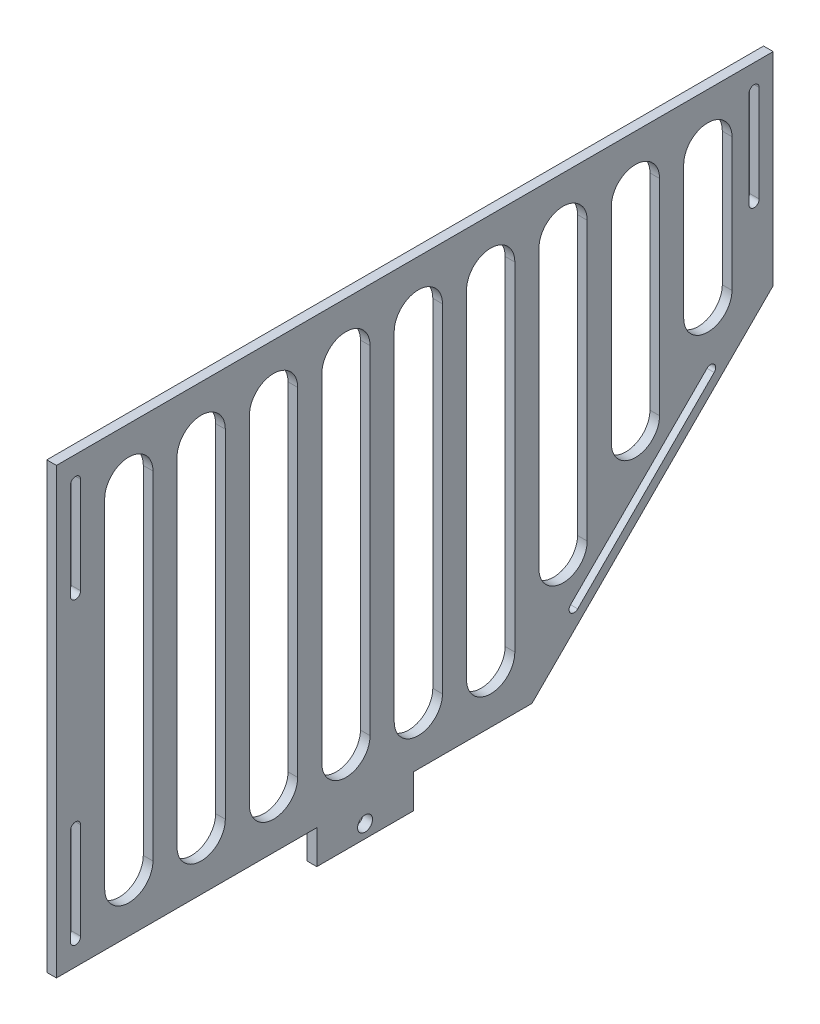
from build123d import *

# Parameters (mm, degrees)
SKETCH_2_W               = 148.55
SKETCH_2_H               = 92
EXTRUDE_1_DEPTH          = 2
CUT_EXTRUDE_1_DEPTH      = 88.388647003
CUT_EXTRUDE_1_DEPTH_BACK = 2
CUT_EXTRUDE_2_DEPTH      = 2
SKETCH_5_W               = 20
SKETCH_5_H               = 7
SKETCH_5_R               = 1.55
EXTRUDE_2_DEPTH          = 2
CUT_EXTRUDE_3_DEPTH      = 2
CUT_EXTRUDE_5_DEPTH      = 2


with BuildPart() as part:
    # 草图2 → 凸台-拉伸1 (new body)
    with BuildSketch(Plane(origin=(0, 0, 0), x_dir=(0, 0, -1), z_dir=(1, 0, 0))):
        Rectangle(SKETCH_2_W, SKETCH_2_H)
    extrude(amount=EXTRUDE_1_DEPTH)

    # 草图3 → 切除-拉伸1 (cut, two sides: drawn at the far end of the back side and taken through both)
    with BuildSketch(Plane(origin=(2, 0, 0), x_dir=(0, 0, -1), z_dir=(1, 0, 0)).offset(-CUT_EXTRUDE_1_DEPTH_BACK)):
        Polygon((-204.458434938, -274.733434938), (24.275, -46), (74.275, 4), (303.008434938, 232.733434938), (760.475304814, -224.733434938), (253.008434938, -732.200304814), align=None)
    extrude(amount=CUT_EXTRUDE_1_DEPTH + CUT_EXTRUDE_1_DEPTH_BACK, mode=Mode.SUBTRACT)

    # 草图4 → 切除-拉伸2 (cut)
    with BuildSketch(Plane(origin=(2, 0, 0), x_dir=(0, 0, -1), z_dir=(1, 0, 0))):
        with BuildLine():
            Line((-71.365, -41), (-71.365, -21))
            ThreePointArc((-71.365, -21), (-70.315, -19.95), (-69.265, -21))
            Line((-69.265, -21), (-69.265, -41))
            ThreePointArc((-69.265, -41), (-70.315, -42.05), (-71.365, -41))
        make_face()
        with BuildLine():
            Line((-71.365, 41), (-71.365, 21))
            ThreePointArc((-71.365, 21), (-70.315, 19.95), (-69.265, 21))
            Line((-69.265, 21), (-69.265, 41))
            ThreePointArc((-69.265, 41), (-70.315, 42.05), (-71.365, 41))
        make_face()
        with BuildLine():
            Line((71.365, 41), (71.365, 21))
            ThreePointArc((71.365, 21), (70.315, 19.95), (69.265, 21))
            Line((69.265, 21), (69.265, 41))
            ThreePointArc((69.265, 41), (70.315, 42.05), (71.365, 41))
        make_face()
    extrude(amount=-CUT_EXTRUDE_2_DEPTH, mode=Mode.SUBTRACT)

    # 草图5 → 凸台-拉伸2 (add)
    with BuildSketch(Plane(origin=(2, 0, 0), x_dir=(0, 0, -1), z_dir=(1, 0, 0))):
        with Locations((-10.315, -49.5)):
            Rectangle(SKETCH_5_W, SKETCH_5_H)
        with Locations((-10.315, -50.25)):
            Circle(SKETCH_5_R, mode=Mode.SUBTRACT)
    extrude(amount=-EXTRUDE_2_DEPTH)

    # 草图6 → 切除-拉伸3 (cut)
    with BuildSketch(Plane(origin=(2, 0, 0), x_dir=(0, 0, -1), z_dir=(1, 0, 0))):
        with BuildLine():
            Line((-64.275, -35), (-64.275, 35))
            ThreePointArc((-64.275, 35), (-59.275, 40), (-54.275, 35))
            Line((-54.275, 35), (-54.275, -35))
            ThreePointArc((-54.275, -35), (-59.275, -40), (-64.275, -35))
        make_face()
        with BuildLine():
            Line((-49.275, -35), (-49.275, 35))
            ThreePointArc((-49.275, 35), (-44.275, 40), (-39.275, 35))
            Line((-39.275, 35), (-39.275, -35))
            ThreePointArc((-39.275, -35), (-44.275, -40), (-49.275, -35))
        make_face()
        with BuildLine():
            Line((-34.275, -35), (-34.275, 35))
            ThreePointArc((-34.275, 35), (-29.275, 40), (-24.275, 35))
            Line((-24.275, 35), (-24.275, -35))
            ThreePointArc((-24.275, -35), (-29.275, -40), (-34.275, -35))
        make_face()
        with BuildLine():
            Line((-19.275, -35), (-19.275, 35))
            ThreePointArc((-19.275, 35), (-14.275, 40), (-9.275, 35))
            Line((-9.275, 35), (-9.275, -35))
            ThreePointArc((-9.275, -35), (-14.275, -40), (-19.275, -35))
        make_face()
        with BuildLine():
            Line((-4.275, -35), (-4.275, 35))
            ThreePointArc((-4.275, 35), (0.725, 40), (5.725, 35))
            Line((5.725, 35), (5.725, -35))
            ThreePointArc((5.725, -35), (0.725, -40), (-4.275, -35))
        make_face()
        with BuildLine():
            Line((10.725, -35), (10.725, 35))
            ThreePointArc((10.725, 35), (15.725, 40), (20.725, 35))
            Line((20.725, 35), (20.725, -35))
            ThreePointArc((20.725, -35), (15.725, -40), (10.725, -35))
        make_face()
        with BuildLine():
            Line((25.725, -22.579437252), (25.725, 35))
            ThreePointArc((25.725, 35), (30.725, 40), (35.725, 35))
            Line((35.725, 35), (35.725, -22.579437252))
            ThreePointArc((35.725, -22.579437252), (30.725, -27.579437252), (25.725, -22.579437252))
        make_face()
        with BuildLine():
            Line((40.725, -7.579437252), (40.725, 35))
            ThreePointArc((40.725, 35), (45.725, 40), (50.725, 35))
            Line((50.725, 35), (50.725, -7.579437252))
            ThreePointArc((50.725, -7.579437252), (45.725, -12.579437252), (40.725, -7.579437252))
        make_face()
        with BuildLine():
            Line((55.725, 7.420562748), (55.725, 35))
            ThreePointArc((55.725, 35), (60.725, 40), (65.725, 35))
            Line((65.725, 35), (65.725, 7.420562748))
            ThreePointArc((65.725, 7.420562748), (60.725, 2.420562748), (55.725, 7.420562748))
        make_face()
    extrude(amount=-CUT_EXTRUDE_3_DEPTH, mode=Mode.SUBTRACT)

    # 草图9 → 切除-拉伸5 (cut)
    with BuildSketch(Plane(origin=(2, 0, 0), x_dir=(0, 0, -1), z_dir=(1, 0, 0))):
        with BuildLine():
            Line((32.269081912, -32.27835316), (60.55335316, -3.994081912))
            ThreePointArc((60.55335316, -3.994081912), (62.0382774, -3.994081912), (62.0382774, -5.479006153))
            Line((62.0382774, -5.479006153), (33.754006153, -33.7632774))
            ThreePointArc((33.754006153, -33.7632774), (32.269081912, -33.7632774), (32.269081912, -32.27835316))
        make_face()
    extrude(amount=-CUT_EXTRUDE_5_DEPTH, mode=Mode.SUBTRACT)


solid = part.part
